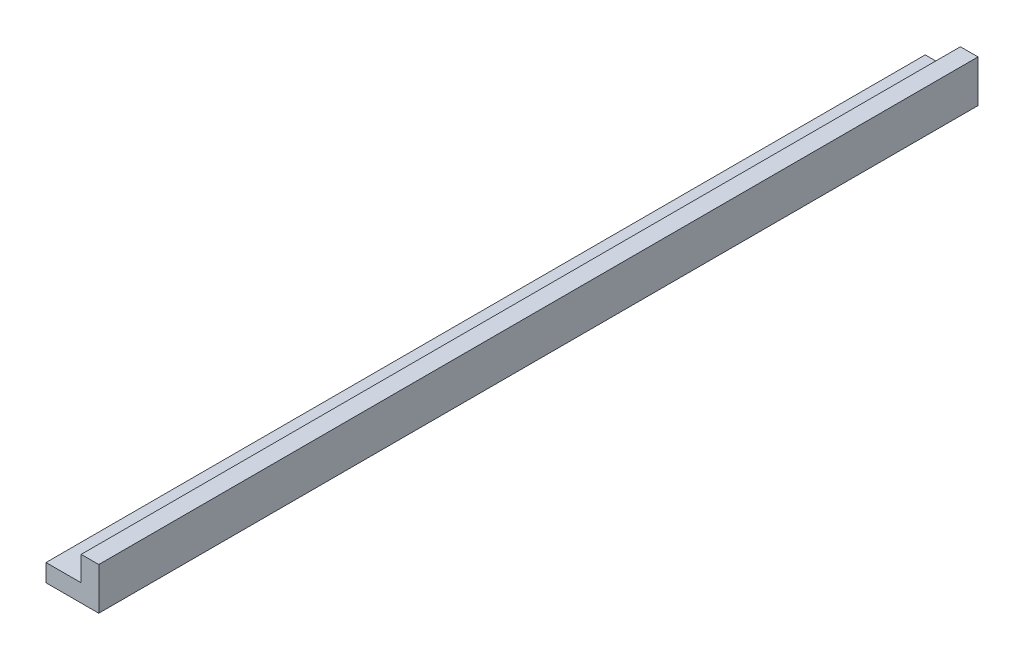
from build123d import *

# Parameters (mm, degrees)
SKETCH_1_W          = 15
SKETCH_1_H          = 250
EXTRUDE_1_DEPTH     = 5
SKETCH_2_W          = 250
SKETCH_2_H          = 12
EXTRUDE_2_DEPTH     = 5
SKETCH_3_R          = 1.75
CUT_EXTRUDE_1_DEPTH = 5


with BuildPart() as part:
    # 草图1 → 凸台-拉伸1 (new body)
    with BuildSketch(Plane(origin=(0, 0, 0), x_dir=(1, 0, 0), z_dir=(0, 1, 0))):
        Rectangle(SKETCH_1_W, SKETCH_1_H)
    extrude(amount=EXTRUDE_1_DEPTH)

    # 草图2 → 凸台-拉伸2 (add)
    with BuildSketch(Plane(origin=(7.5, 0, 0), x_dir=(0, 0, -1), z_dir=(1, 0, 0))):
        with Locations((0, 6)):
            Rectangle(SKETCH_2_W, SKETCH_2_H)
    extrude(amount=-EXTRUDE_2_DEPTH)

    # 草图3 → 切除-拉伸1 (cut)
    with BuildSketch(Plane(origin=(0, 5, 0), x_dir=(1, 0, 0), z_dir=(0, 1, 0))):
        with Locations(Location((-2.5, 100, 0), (0, 0, 270))):
            Circle(SKETCH_3_R)
        with Locations(Location((-2.5, 0, 0), (0, 0, 270))):
            Circle(SKETCH_3_R)
        with Locations(Location((-2.5, -100, 0), (0, 0, 270))):
            Circle(SKETCH_3_R)
    extrude(amount=-CUT_EXTRUDE_1_DEPTH, mode=Mode.SUBTRACT)


solid = part.part
